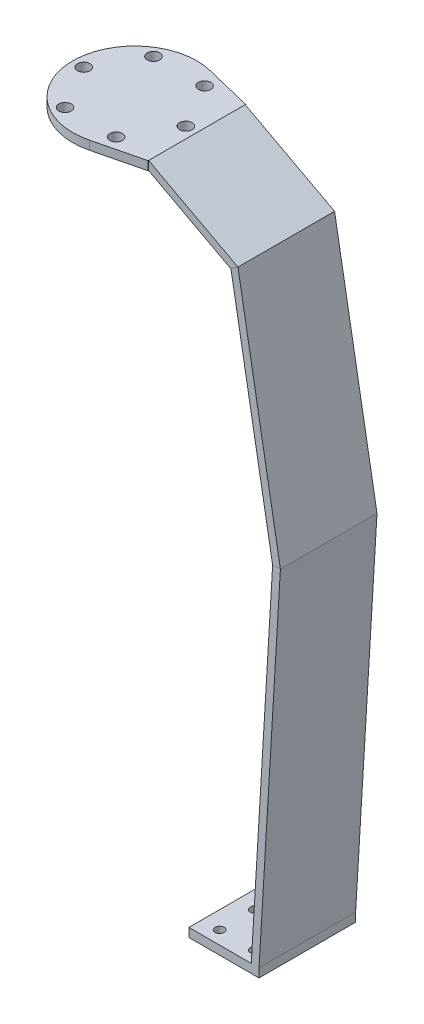
from build123d import *

# Parameters (mm, degrees)
SKETCH2_R               = 22.5
SKETCH2_R_2             = 2.25
BOSS_EXTRUDE1_DEPTH     = 3.175
SKETCH1_W               = 25.4
SKETCH1_H               = 35
SKETCH1_R               = 1.63
BOSS_EXTRUDE2_DEPTH     = 3.175
BOSS_EXTRUDE6_DEPTH     = 3.175
TOP_CONNECTION_SKETCH_W = 35
TOP_CONNECTION_SKETCH_H = 3.175


with BuildPart() as part:
    # Sketch2 → Boss-Extrude1 (new body)
    with BuildSketch(Plane(origin=(0, 236.49, 0), x_dir=(1, 0, 0), z_dir=(0, 1, 0))):
        with Locations(Location((0, 0, 0), (0, 0, 270))):
            Circle(SKETCH2_R)
        with Locations(Location((9.25, 16.02146997, 0), (0, 0, 270))):
            Circle(SKETCH2_R_2, mode=Mode.SUBTRACT)
        with Locations(Location((18.5, 0, 0), (0, 0, 270))):
            Circle(SKETCH2_R_2, mode=Mode.SUBTRACT)
        with Locations(Location((9.25, -16.02146997, 0), (0, 0, 270))):
            Circle(SKETCH2_R_2, mode=Mode.SUBTRACT)
        with Locations(Location((-9.25, -16.02146997, 0), (0, 0, 270))):
            Circle(SKETCH2_R_2, mode=Mode.SUBTRACT)
        with Locations(Location((-18.5, 0, 0), (0, 0, 270))):
            Circle(SKETCH2_R_2, mode=Mode.SUBTRACT)
        with Locations(Location((-9.25, 16.02146997, 0), (0, 0, 270))):
            Circle(SKETCH2_R_2, mode=Mode.SUBTRACT)
    extrude(amount=-BOSS_EXTRUDE1_DEPTH)

    # Sketch8 → Boss-Extrude6 (add)
    with BuildSketch(Plane(origin=(0, 236.49, 0), x_dir=(1, 0, 0), z_dir=(0, 1, 0))):
        Polygon((22.5, -17.648859957), (22.5, 0), (20.75, 0), (19.341522111, -11.495891545), (5.359057513, -21.852471315), align=None)
        Polygon((22.5, 0), (22.5, 17.648859957), (5.359057513, 21.852471315), (19.341522111, 11.495891545), (20.75, 0), align=None)
    extrude(amount=-BOSS_EXTRUDE6_DEPTH)



with BuildPart() as body_2:
    # Sketch1 → Boss-Extrude2 (new body)
    with BuildSketch(Plane(origin=(0, 0, 0), x_dir=(1, 0, 0), z_dir=(0, 1, 0))):
        with Locations((49.8, 0)):
            Rectangle(SKETCH1_W, SKETCH1_H)
        with Locations(Location((43.45, 0, 0), (0, 0, 270))):
            Circle(SKETCH1_R, mode=Mode.SUBTRACT)
        with Locations(Location((56.15, 0, 0), (0, 0, 270))):
            Circle(SKETCH1_R, mode=Mode.SUBTRACT)
        with Locations(Location((43.45, 12.7, 0), (0, 0, 270))):
            Circle(SKETCH1_R, mode=Mode.SUBTRACT)
        with Locations(Location((56.15, 12.7, 0), (0, 0, 270))):
            Circle(SKETCH1_R, mode=Mode.SUBTRACT)
        with Locations(Location((43.45, -12.7, 0), (0, 0, 270))):
            Circle(SKETCH1_R, mode=Mode.SUBTRACT)
        with Locations(Location((56.15, -12.7, 0), (0, 0, 270))):
            Circle(SKETCH1_R, mode=Mode.SUBTRACT)
    extrude(amount=BOSS_EXTRUDE2_DEPTH)


with BuildPart() as part_1:
    add(part.part)

    add(body_2.part)  # Sweep1 merges body 2
    # Sweep1: sweep along a curve in space
    with BuildLine() as sweep1_path:
        Line((22.5, 236.49, 0), (54.871837923, 219.215989902, 0))
        Line((70.25, 132.157447282, 0), (54.871837923, 219.215989902, 0))
        Line((62.5, 3.175, 0), (70.25, 132.157447282, 0))
    # Top_Connection_Sketch → Sweep1 (sweep)
    with BuildSketch(Plane(origin=(22.5, 0, 0), x_dir=(0, 0, -1), z_dir=(1, 0, 0))):
        with Locations((0, 234.9025)):
            Rectangle(TOP_CONNECTION_SKETCH_W, TOP_CONNECTION_SKETCH_H)
    sweep(path=sweep1_path.line, transition=Transition.RIGHT)


solid = part_1.part
